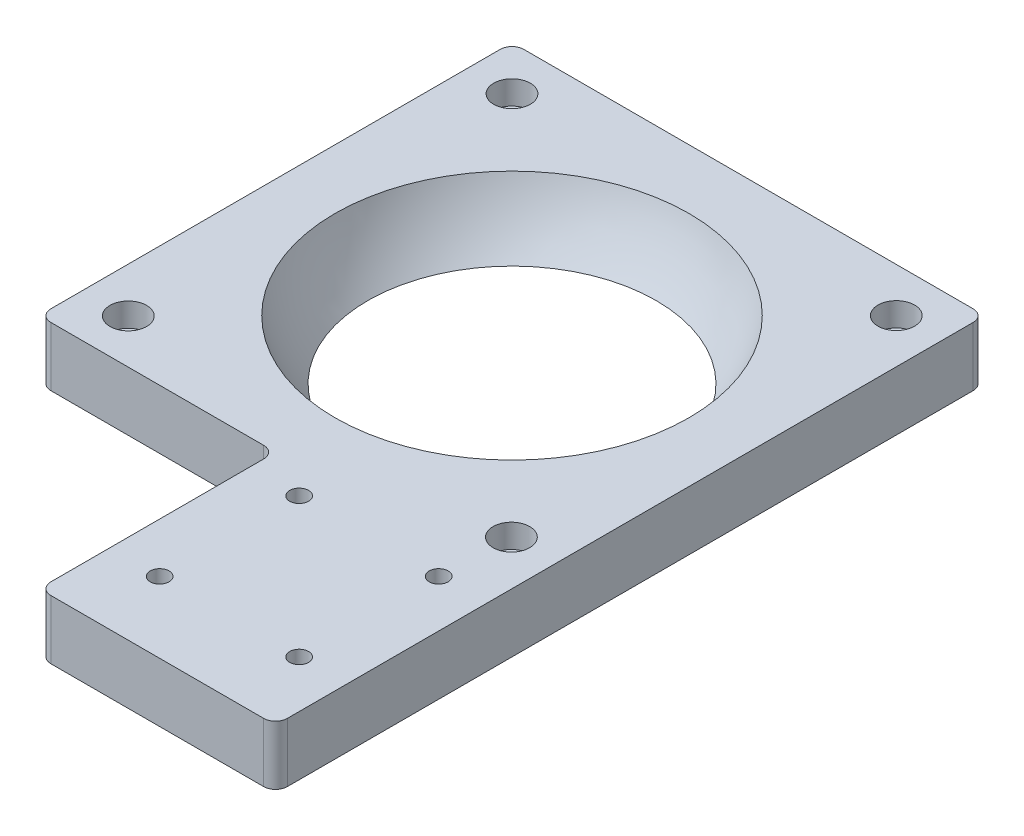
from build123d import *

# Parameters (mm, degrees)
SKETCH1_W           = 101.6
SKETCH1_H           = 101.6
BOSS_EXTRUDE1_DEPTH = 12.7
SKETCH4_R           = 2.54
CUT_EXTRUDE3_DEPTH  = 73.955945768
SKETCH6_R           = 3.937
CUT_EXTRUDE4_DEPTH  = 5.08
FILLET2_R           = 2.54
BOSS_EXTRUDE2_DEPTH = 12.7
SKETCH8_R           = 3.937
CUT_EXTRUDE5_DEPTH  = 5.08
SKETCH9_R           = 2.54
CUT_EXTRUDE6_DEPTH  = 115.300000144
FILLET4_R           = 2.54
SKETCH11_R          = 2.032
CUT_EXTRUDE7_DEPTH  = 115.300000144
SKETCH12_W          = 50.8
SKETCH12_H          = 50.8
CUT_EXTRUDE8_DEPTH  = 115.300000144
FILLET5_R           = 2.54


with BuildPart() as part:
    # Sketch1 → Boss-Extrude1 (new body)
    with BuildSketch(Plane(origin=(0, 0, 0), x_dir=(1, 0, 0), z_dir=(0, 1, 0))):
        Rectangle(SKETCH1_W, SKETCH1_H)
    extrude(amount=BOSS_EXTRUDE1_DEPTH)

    # Sketch5 → Cut-Revolve1 (revolve, cut)
    with BuildSketch(Plane.XY, mode=Mode.PRIVATE) as cut_revolve1_sk:
        with BuildLine():
            Line((0, 0), (30.988, 0))
            ThreePointArc((30.988, 0), (35.469857517, 6.88539078), (38.608, 14.478))
            Line((38.608, 14.478), (0, 14.478))
            Line((0, 14.478), (0, 0))
        make_face()
    revolve(cut_revolve1_sk.sketch.rotate(Axis((0, 0, 0), (0, 1, 0)), 90), axis=Axis((0, 0, 0), (0, 1, 0)), mode=Mode.SUBTRACT)

    # Sketch4 → Cut-Extrude3 (cut, through all)
    with BuildSketch(Plane(origin=(0, 12.7, 0), x_dir=(1, 0, 0), z_dir=(0, 1, 0))):
        with Locations(Location((-41.275, 41.275, 0), (0, 0, 270))):
            Circle(SKETCH4_R)
        with Locations(Location((41.275, 41.275, 0), (0, 0, 270))):
            Circle(SKETCH4_R)
    extrude(amount=-CUT_EXTRUDE3_DEPTH, mode=Mode.SUBTRACT)

    # Sketch6 → Cut-Extrude4 (cut)
    with BuildSketch(Plane(origin=(0, 12.7, 0), x_dir=(1, 0, 0), z_dir=(0, 1, 0))):
        with Locations(Location((-41.275, 41.275, 0), (0, 0, 270))):
            Circle(SKETCH6_R)
        with Locations(Location((41.275, 41.275, 0), (0, 0, 270))):
            Circle(SKETCH6_R)
    extrude(amount=-CUT_EXTRUDE4_DEPTH, mode=Mode.SUBTRACT)

    # Fillet2
    fillet2_edges = [part.edges().sort_by_distance(p)[0] for p in [
        (50.8, 6.35, 50.8),
        (-50.8, 6.35, 50.8),
        (-50.8, 6.35, -50.8),
        (50.8, 6.35, -50.8),
    ]]
    fillet(fillet2_edges, radius=FILLET2_R)

    # Sketch7 → Boss-Extrude2 (add)
    with BuildSketch(Plane(origin=(0, 12.7, 0), x_dir=(1, 0, 0), z_dir=(0, 1, 0))):
        with BuildLine():
            Line((-50.8, -101.6), (50.8, -101.6))
            Line((50.8, -101.6), (50.8, -48.26))
            ThreePointArc((50.8, -48.26), (50.056051224, -50.056051224), (48.26, -50.8))
            Line((48.26, -50.8), (-48.26, -50.8))
            ThreePointArc((-48.26, -50.8), (-50.056051224, -50.056051224), (-50.8, -48.26))
            Line((-50.8, -48.26), (-50.8, -101.6))
        make_face()
    extrude(amount=-BOSS_EXTRUDE2_DEPTH)

    # Sketch8 → Cut-Extrude5 (cut)
    with BuildSketch(Plane(origin=(0, 12.7, 0), x_dir=(1, 0, 0), z_dir=(0, 1, 0))):
        with Locations(Location((-41.148, -41.275, 0), (0, 0, 270))):
            Circle(SKETCH8_R)
        with Locations(Location((41.148, -41.275, 0), (0, 0, 270))):
            Circle(SKETCH8_R)
    extrude(amount=-CUT_EXTRUDE5_DEPTH, mode=Mode.SUBTRACT)

    # Sketch9 → Cut-Extrude6 (cut, through all)
    with BuildSketch(Plane(origin=(0, 12.7, 0), x_dir=(1, 0, 0), z_dir=(0, 1, 0))):
        with Locations(Location((-41.148, -41.275, 0), (0, 0, 270))):
            Circle(SKETCH9_R)
        with Locations(Location((41.148, -41.275, 0), (0, 0, 270))):
            Circle(SKETCH9_R)
    extrude(amount=-CUT_EXTRUDE6_DEPTH, mode=Mode.SUBTRACT)

    # Fillet4
    fillet4_edges = [part.edges().sort_by_distance(p)[0] for p in [
        (-50.8, 6.35, 101.6),
        (50.8, 6.35, 101.6),
    ]]
    fillet(fillet4_edges, radius=FILLET4_R)

    # Sketch11 → Cut-Extrude7 (cut, through all)
    with BuildSketch(Plane(origin=(0, 12.7, 0), x_dir=(1, 0, 0), z_dir=(0, 1, 0))):
        with Locations(Location((10.668, -56.388, 0), (0, 0, 270))):
            Circle(SKETCH11_R)
        with Locations(Location((10.668, -86.36, 0), (0, 0, 270))):
            Circle(SKETCH11_R)
        with Locations(Location((40.64, -86.36, 0), (0, 0, 270))):
            Circle(SKETCH11_R)
        with Locations(Location((40.64, -56.388, 0), (0, 0, 270))):
            Circle(SKETCH11_R)
    extrude(amount=-CUT_EXTRUDE7_DEPTH, mode=Mode.SUBTRACT)

    # Sketch12 → Cut-Extrude8 (cut, through all)
    with BuildSketch(Plane(origin=(0, 12.7, 0), x_dir=(1, 0, 0), z_dir=(0, 1, 0))):
        with Locations((-25.4, -76.2)):
            Rectangle(SKETCH12_W, SKETCH12_H)
    extrude(amount=-CUT_EXTRUDE8_DEPTH, mode=Mode.SUBTRACT)

    # Fillet5
    fillet5_edges = [part.edges().sort_by_distance(p)[0] for p in [
        (0, 6.35, 101.6),
        (0, 6.35, 50.8),
        (-50.8, 6.35, 50.8),
    ]]
    fillet(fillet5_edges, radius=FILLET5_R)


solid = part.part
